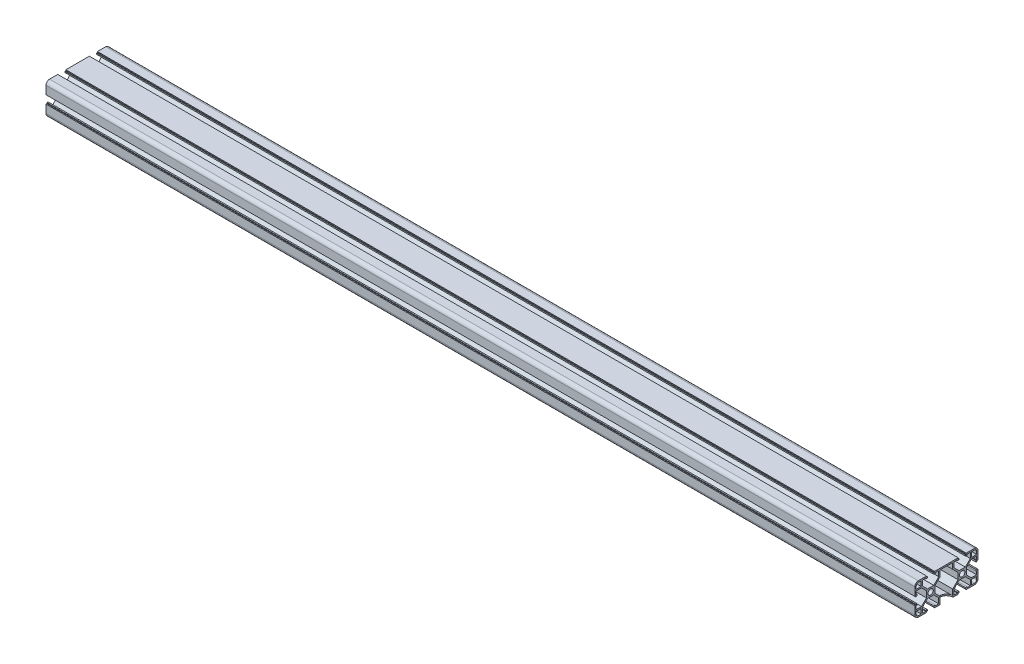
from build123d import *

# Parameters (mm, degrees)
SKETCH_110_R                     = 3.4
MEMBER_4080_2_0_4080_2_0_1_DEPTH = 1100
CUT_EXTRUDE_1_REACH              = 1104.297


with BuildPart() as part:
    # 草图110 → Member 4080-_2.0 _4080-_2.0_1 (new body)
    with BuildSketch(Plane(origin=(0, 0, 0), x_dir=(0, 0, -1), z_dir=(1, 0, 0))):
        with BuildLine():
            Line((-5.25, -3.977207794), (-5.25, 3.977207794))
            Line((-5.25, 3.977207794), (-11.522792206, 10.25))
            Line((-11.522792206, 10.25), (-18.2, 10.25))
            Line((-18.2, 10.25), (-18.2, 6.1))
            Line((-18.2, 6.1), (-17.3, 6.1))
            Line((-17.3, 6.1), (-17.3, 4.1))
            Line((-17.3, 4.1), (-18.8, 4.1))
            Line((-18.8, 4.1), (-18.8, 5.1))
            Line((-18.8, 5.1), (-20, 5.1))
            Line((-20, 5.1), (-20, 15.5))
            ThreePointArc((-20, 15.5), (-18.681980515, 18.681980515), (-15.5, 20))
            Line((-15.5, 20), (-5.1, 20))
            Line((-5.1, 20), (-5.1, 18.8))
            Line((-5.1, 18.8), (-4.1, 18.8))
            Line((-4.1, 18.8), (-4.1, 17.3))
            Line((-4.1, 17.3), (-6.1, 17.3))
            Line((-6.1, 17.3), (-6.1, 18.2))
            Line((-6.1, 18.2), (-10.25, 18.2))
            Line((-10.25, 18.2), (-10.25, 11.522792206))
            Line((-10.25, 11.522792206), (-3.977207794, 5.25))
            Line((-3.977207794, 5.25), (3.977207794, 5.25))
            Line((3.977207794, 5.25), (10.25, 11.522792206))
            Line((10.25, 11.522792206), (10.25, 18.2))
            Line((10.25, 18.2), (6.1, 18.2))
            Line((6.1, 18.2), (6.1, 17.3))
            Line((6.1, 17.3), (4.1, 17.3))
            Line((4.1, 17.3), (4.1, 18.8))
            Line((4.1, 18.8), (5.1, 18.8))
            Line((5.1, 18.8), (5.1, 20))
            Line((5.1, 20), (15.5, 20))
            Line((15.5, 20), (24.5, 20))
            Line((24.5, 20), (34.9, 20))
            Line((34.9, 20), (34.9, 18.8))
            Line((34.9, 18.8), (35.9, 18.8))
            Line((35.9, 18.8), (35.9, 17.3))
            Line((35.9, 17.3), (33.9, 17.3))
            Line((33.9, 17.3), (33.9, 18.2))
            Line((33.9, 18.2), (29.75, 18.2))
            Line((29.75, 18.2), (29.75, 11.522792206))
            Line((29.75, 11.522792206), (36.022792206, 5.25))
            Line((36.022792206, 5.25), (43.977207794, 5.25))
            Line((43.977207794, 5.25), (50.25, 11.522792206))
            Line((50.25, 11.522792206), (50.25, 18.2))
            Line((50.25, 18.2), (46.1, 18.2))
            Line((46.1, 18.2), (46.1, 17.3))
            Line((46.1, 17.3), (44.1, 17.3))
            Line((44.1, 17.3), (44.1, 18.8))
            Line((44.1, 18.8), (45.1, 18.8))
            Line((45.1, 18.8), (45.1, 20))
            Line((45.1, 20), (55.5, 20))
            ThreePointArc((55.5, 20), (58.681980515, 18.681980515), (60, 15.5))
            Line((60, 15.5), (60, 5.1))
            Line((60, 5.1), (58.8, 5.1))
            Line((58.8, 5.1), (58.8, 4.1))
            Line((58.8, 4.1), (57.3, 4.1))
            Line((57.3, 4.1), (57.3, 6.1))
            Line((57.3, 6.1), (58.2, 6.1))
            Line((58.2, 6.1), (58.2, 10.25))
            Line((58.2, 10.25), (51.522792206, 10.25))
            Line((51.522792206, 10.25), (45.25, 3.977207794))
            Line((45.25, 3.977207794), (45.25, -3.977207794))
            Line((45.25, -3.977207794), (51.522792206, -10.25))
            Line((51.522792206, -10.25), (58.2, -10.25))
            Line((58.2, -10.25), (58.2, -6.1))
            Line((58.2, -6.1), (57.3, -6.1))
            Line((57.3, -6.1), (57.3, -4.1))
            Line((57.3, -4.1), (58.8, -4.1))
            Line((58.8, -4.1), (58.8, -5.1))
            Line((58.8, -5.1), (60, -5.1))
            Line((60, -5.1), (60, -15.5))
            ThreePointArc((60, -15.5), (58.681980515, -18.681980515), (55.5, -20))
            Line((55.5, -20), (45.1, -20))
            Line((45.1, -20), (45.1, -18.8))
            Line((45.1, -18.8), (44.1, -18.8))
            Line((44.1, -18.8), (44.1, -17.3))
            Line((44.1, -17.3), (46.1, -17.3))
            Line((46.1, -17.3), (46.1, -18.2))
            Line((46.1, -18.2), (50.25, -18.2))
            Line((50.25, -18.2), (50.25, -11.522792206))
            Line((50.25, -11.522792206), (43.977207794, -5.25))
            Line((43.977207794, -5.25), (36.022792206, -5.25))
            Line((36.022792206, -5.25), (29.75, -11.522792206))
            Line((29.75, -11.522792206), (29.75, -18.2))
            Line((29.75, -18.2), (33.9, -18.2))
            Line((33.9, -18.2), (33.9, -17.3))
            Line((33.9, -17.3), (35.9, -17.3))
            Line((35.9, -17.3), (35.9, -18.8))
            Line((35.9, -18.8), (34.9, -18.8))
            Line((34.9, -18.8), (34.9, -20))
            Line((34.9, -20), (24.5, -20))
            Line((24.5, -20), (15.5, -20))
            Line((15.5, -20), (5.1, -20))
            Line((5.1, -20), (5.1, -18.8))
            Line((5.1, -18.8), (4.1, -18.8))
            Line((4.1, -18.8), (4.1, -17.3))
            Line((4.1, -17.3), (6.1, -17.3))
            Line((6.1, -17.3), (6.1, -18.2))
            Line((6.1, -18.2), (10.25, -18.2))
            Line((10.25, -18.2), (10.25, -11.522792206))
            Line((10.25, -11.522792206), (3.977207794, -5.25))
            Line((3.977207794, -5.25), (-3.977207794, -5.25))
            Line((-3.977207794, -5.25), (-10.25, -11.522792206))
            Line((-10.25, -11.522792206), (-10.25, -18.2))
            Line((-10.25, -18.2), (-6.1, -18.2))
            Line((-6.1, -18.2), (-6.1, -17.3))
            Line((-6.1, -17.3), (-4.1, -17.3))
            Line((-4.1, -17.3), (-4.1, -18.8))
            Line((-4.1, -18.8), (-5.1, -18.8))
            Line((-5.1, -18.8), (-5.1, -20))
            Line((-5.1, -20), (-15.5, -20))
            ThreePointArc((-15.5, -20), (-18.681980515, -18.681980515), (-20, -15.5))
            Line((-20, -15.5), (-20, -5.1))
            Line((-20, -5.1), (-18.8, -5.1))
            Line((-18.8, -5.1), (-18.8, -4.1))
            Line((-18.8, -4.1), (-17.3, -4.1))
            Line((-17.3, -4.1), (-17.3, -6.1))
            Line((-17.3, -6.1), (-18.2, -6.1))
            Line((-18.2, -6.1), (-18.2, -10.25))
            Line((-18.2, -10.25), (-11.522792206, -10.25))
            Line((-11.522792206, -10.25), (-5.25, -3.977207794))
        make_face()
        Circle(SKETCH_110_R, mode=Mode.SUBTRACT)
        with Locations((40, 0)):
            Circle(SKETCH_110_R, mode=Mode.SUBTRACT)
        with BuildLine():
            Line((-12.05, 12.05), (-18.2, 12.05))
            Line((-18.2, 12.05), (-18.2, 15.5))
            ThreePointArc((-18.2, 15.5), (-17.409188309, 17.409188309), (-15.5, 18.2))
            Line((-15.5, 18.2), (-12.05, 18.2))
            Line((-12.05, 18.2), (-12.05, 12.05))
        make_face(mode=Mode.SUBTRACT)
        Polygon((5.25, 3.977207794), (11.522792206, 10.25), (12.05, 10.777207794), (12.05, 12.05), (12.05, 18.2), (15.5, 18.2), (24.5, 18.2), (27.95, 18.2), (27.95, 12.05), (27.95, 10.777207794), (28.477207794, 10.25), (34.75, 3.977207794), (34.75, -3.977207794), (28.477207794, -10.25), (27.95, -10.777207794), (27.95, -12.05), (27.95, -18.2), (24.5, -18.2), (15.5, -18.2), (12.05, -18.2), (12.05, -12.05), (12.05, -10.777207794), (11.522792206, -10.25), (5.25, -3.977207794), align=None, mode=Mode.SUBTRACT)
        with BuildLine():
            Line((-12.05, -12.05), (-12.05, -18.2))
            Line((-12.05, -18.2), (-15.5, -18.2))
            ThreePointArc((-15.5, -18.2), (-17.409188309, -17.409188309), (-18.2, -15.5))
            Line((-18.2, -15.5), (-18.2, -12.05))
            Line((-18.2, -12.05), (-12.05, -12.05))
        make_face(mode=Mode.SUBTRACT)
        with BuildLine():
            Line((52.05, -12.05), (58.2, -12.05))
            Line((58.2, -12.05), (58.2, -15.5))
            ThreePointArc((58.2, -15.5), (57.409188309, -17.409188309), (55.5, -18.2))
            Line((55.5, -18.2), (52.05, -18.2))
            Line((52.05, -18.2), (52.05, -12.05))
        make_face(mode=Mode.SUBTRACT)
        with BuildLine():
            Line((52.05, 12.05), (52.05, 18.2))
            Line((52.05, 18.2), (55.5, 18.2))
            ThreePointArc((55.5, 18.2), (57.409188309, 17.409188309), (58.2, 15.5))
            Line((58.2, 15.5), (58.2, 12.05))
            Line((58.2, 12.05), (52.05, 12.05))
        make_face(mode=Mode.SUBTRACT)
    extrude(amount=MEMBER_4080_2_0_4080_2_0_1_DEPTH)

    # 草图13 → 切除-拉伸1 (cut, up to next)
    with BuildSketch(Plane(origin=(0, -18.2, 0), x_dir=(1, 0, 0), z_dir=(0, 1, 0)), mode=Mode.PRIVATE) as cut_extrude_1_sk1:
        with BuildLine():
            Line((1180, 11.75), (1100, 11.75))
            ThreePointArc((1100, 11.75), (1091.75, 20), (1100, 28.25))
            Line((1100, 28.25), (1180, 28.25))
            ThreePointArc((1180, 28.25), (1188.25, 20), (1180, 11.75))
        make_face()
    cut_extrude_1_tool1 = extrude(cut_extrude_1_sk1.sketch, amount=-CUT_EXTRUDE_1_REACH, mode=Mode.PRIVATE) & part.part
    add(cut_extrude_1_tool1.solids().sort_by_distance((1140, -18.2, -20))[0], mode=Mode.SUBTRACT)


solid = part.part
